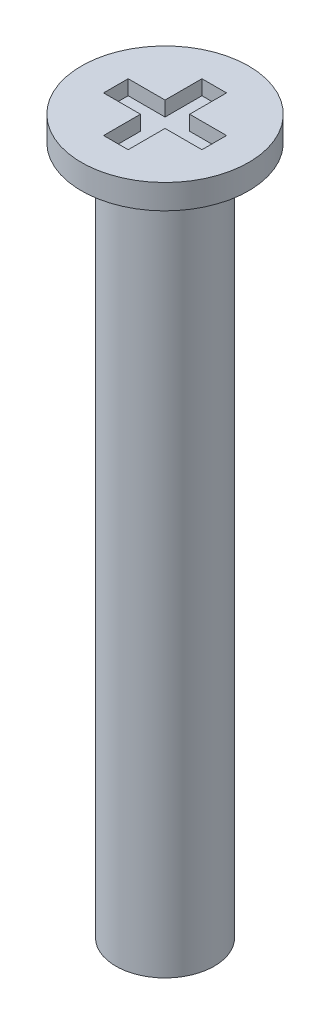
from build123d import *

# Parameters (mm, degrees)
SKETCH_2_W               = 0.5
SKETCH_2_H               = 1
CUT_EXTRUDE_1_DEPTH      = 0.3
PATTERN_CIRCULAR_1_COUNT = 4


with BuildPart() as part:
    # ｽｹｯﾁ1 → 回転1 (revolve)
    with BuildSketch(Plane.XY, mode=Mode.PRIVATE) as revolve_1_sk:
        Polygon((0, 0), (1.7, 0), (1.7, -0.5), (1, -0.5), (1, -14.5), (0, -14.5), align=None)
    revolve(revolve_1_sk.sketch.rotate(Axis((0, -14.5, 0), (0, 1, 0)), 90), axis=Axis((0, -14.5, 0), (0, 1, 0)))

    # ｽｹｯﾁ2 → ｶｯﾄ - 押し出し1 (cut)
    with BuildSketch(Plane(origin=(0, 0, 0), x_dir=(1, 0, 0), z_dir=(0, 1, 0))):
        with Locations((0, 0.5)):
            Rectangle(SKETCH_2_W, SKETCH_2_H)
    cut_extrude_1 = extrude(amount=-CUT_EXTRUDE_1_DEPTH, mode=Mode.SUBTRACT)

    # 円形ﾊﾟﾀｰﾝ1: ｶｯﾄ - 押し出し1 ×4 about axis
    pattern_circular_1_axis = Axis((0, 0, 0), (0, 1, 0))
    for i in range(1, PATTERN_CIRCULAR_1_COUNT):
        add(cut_extrude_1.rotate(pattern_circular_1_axis, i * 360 / PATTERN_CIRCULAR_1_COUNT), mode=Mode.SUBTRACT)


solid = part.part
